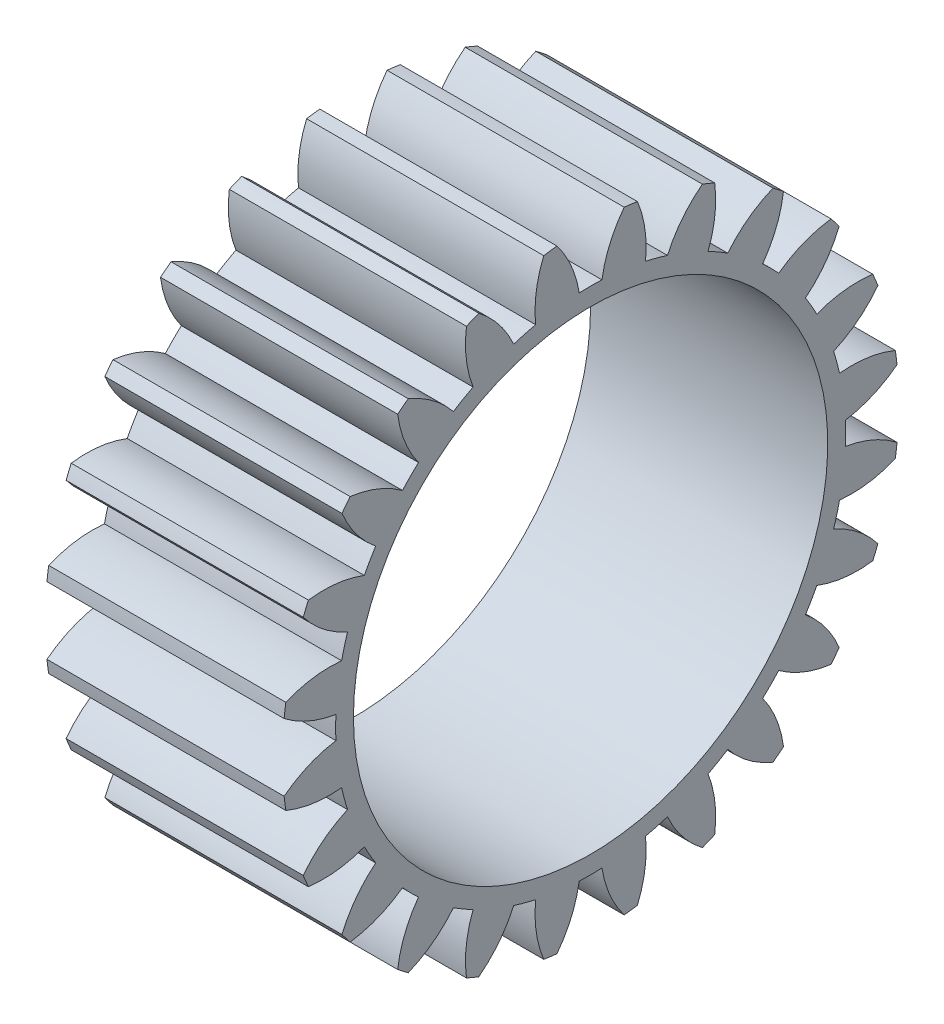
from build123d import *

# Parameters (mm, degrees)
BASPROSKE_W     = 15
BASPROSKE_H     = 19.5
TOOTHCUT_DEPTH  = 32.392674305
TEETHCUTS_COUNT = 24
TEETHCUTS_ANGLE = 345
BORSKE_R        = 15
BORE_DEPTH      = 50.0000508


with BuildPart() as part:
    # BasProSke → Base-Revolve (revolve)
    with BuildSketch(Plane(origin=(0, 0, 0), x_dir=(1, 0, 0), z_dir=(0, 1, 0)), mode=Mode.PRIVATE) as base_revolve_sk:
        with Locations((7.5, 9.75)):
            Rectangle(BASPROSKE_W, BASPROSKE_H)
    revolve(base_revolve_sk.sketch.rotate(Axis((-10, 0, 0), (1, 0, 0)), 180), axis=Axis((-10, 0, 0), (1, 0, 0)))

    # TooCutSke → ToothCut (cut, through all)
    with BuildSketch(Plane(origin=(0, 0, 0), x_dir=(0, 0, -1), z_dir=(1, 0, 0))):
        with BuildLine():
            ThreePointArc((0.718975251, 16.107962335), (0, 16.124), (-0.718975251, 16.107962335))
            ThreePointArc((-0.718975251, 16.107962335), (-1.222639001, 17.848001425), (-2.144665446, 19.407257799))
            ThreePointArc((-2.144665446, 19.407257799), (0, 19.5254), (2.144665446, 19.407257799))
            ThreePointArc((2.144665446, 19.407257799), (1.222639001, 17.848001425), (0.718975251, 16.107962335))
        make_face()
    toothcut = extrude(amount=TOOTHCUT_DEPTH, mode=Mode.SUBTRACT)

    # TeethCuts: ToothCut ×24 about axis
    teethcuts_axis = Axis((-10, 0, 0), (1, 0, 0))
    for i in range(1, TEETHCUTS_COUNT):
        add(toothcut.rotate(teethcuts_axis, i * TEETHCUTS_ANGLE / (TEETHCUTS_COUNT - 1)), mode=Mode.SUBTRACT)

    # BorSke → Bore (cut, symmetric)
    with BuildSketch(Plane(origin=(0, 0, 0), x_dir=(0, 0, -1), z_dir=(1, 0, 0))):
        with Locations(Location((0, 0, 0), (0, 0, 180))):
            Circle(BORSKE_R)
    extrude(amount=BORE_DEPTH, both=True, mode=Mode.SUBTRACT)


solid = part.part
